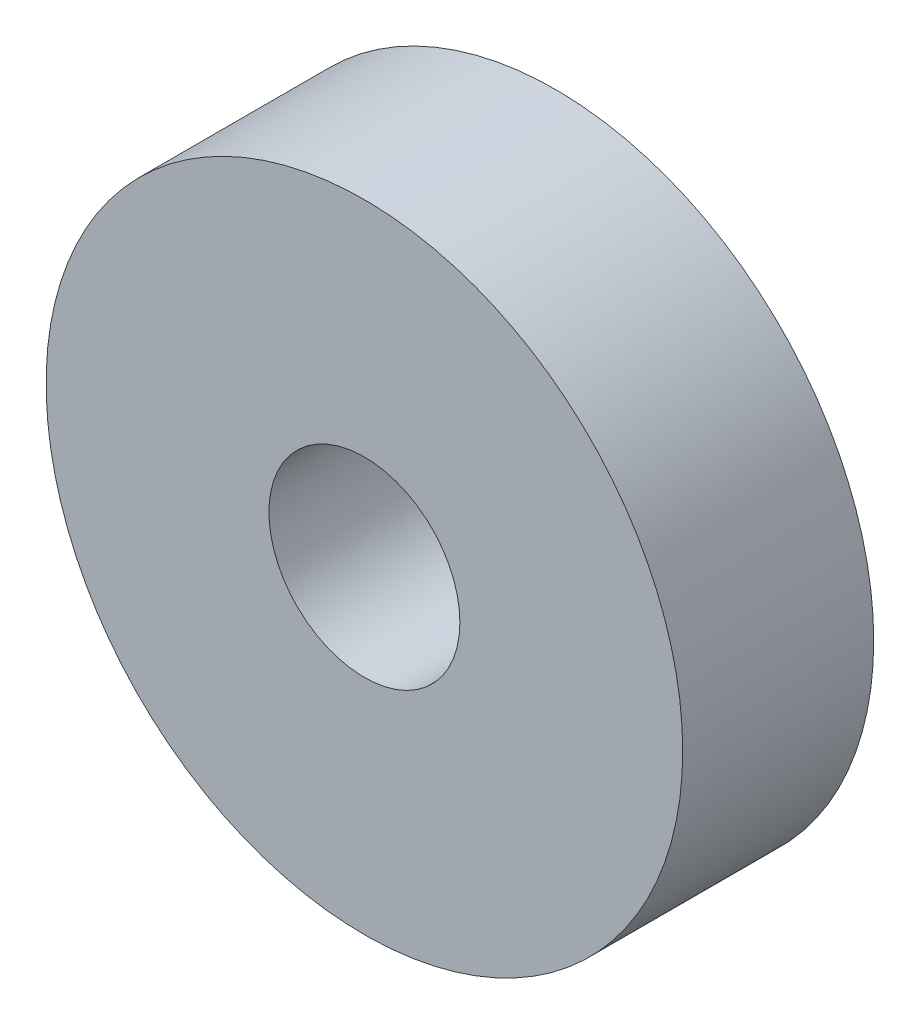
from build123d import *

# Parameters (mm, degrees)
ESBO_O1_R                = 5
ESBO_O1_R_2              = 1.5
RESSALTO_EXTRUS_O1_DEPTH = 3


with BuildPart() as part:
    # Esboço1 → Ressalto-extrusão1 (new body)
    with BuildSketch(Plane.XY):
        Circle(ESBO_O1_R)
        Circle(ESBO_O1_R_2, mode=Mode.SUBTRACT)
    extrude(amount=RESSALTO_EXTRUS_O1_DEPTH)


solid = part.part
